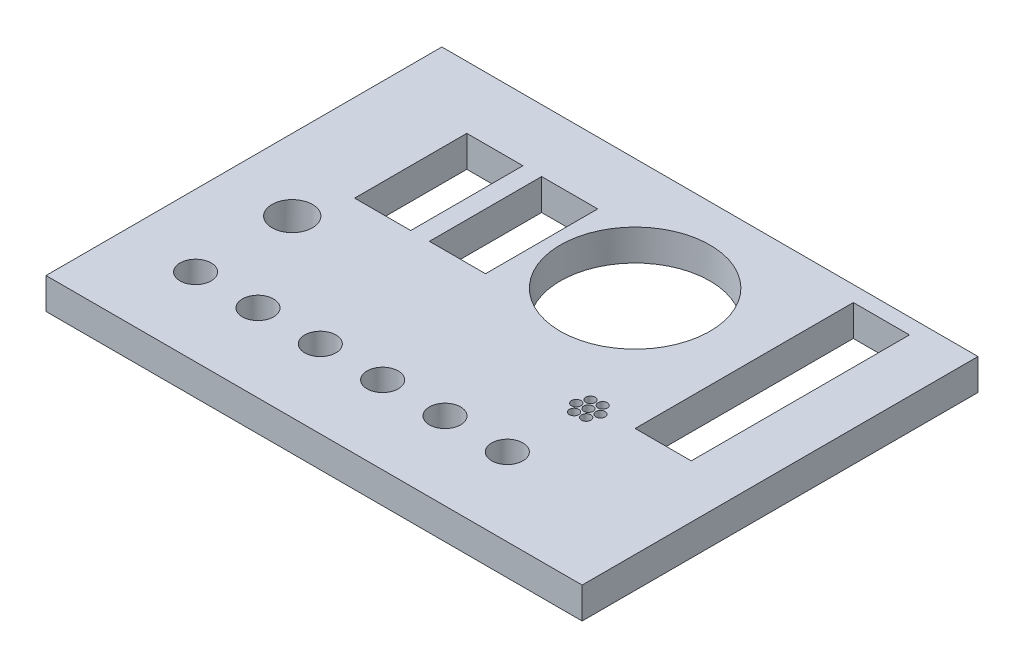
from build123d import *

# Parameters (mm, degrees)
SKICA2_W                 = 86
SKICA2_H                 = 63.5
P_IDAT_VYSUNUT_M1_DEPTH  = 5
ODEBRAT_VYSUNUT_M1_REACH = 55.685
SKICA4_R                 = 2.5
SKICA4_R_2               = 3.25
SKICA4_R_3               = 12
SKICA4_R_4               = 0.75
SKICA4_W                 = 9
SKICA4_H                 = 18
SKICA4_H_2               = 35


with BuildPart() as part:
    # Skica2 → Přidat vysunutím1 (new body)
    with BuildSketch(Plane(origin=(0, 0, 0), x_dir=(1, 0, 0), z_dir=(0, 1, 0))):
        Rectangle(SKICA2_W, SKICA2_H)
    extrude(amount=P_IDAT_VYSUNUT_M1_DEPTH)

    # Skica4 → Odebrat vysunutím1 (cut, up to next)
    with BuildSketch(Plane(origin=(0, 5, 0), x_dir=(1, 0, 0), z_dir=(0, 1, 0)), mode=Mode.PRIVATE) as odebrat_vysunut_m1_sk1:
        with Locations(Location((-31.5, -19.25, 0), (0, 0, 270))):
            Circle(SKICA4_R)
    odebrat_vysunut_m1_tool1 = extrude(odebrat_vysunut_m1_sk1.sketch, amount=-ODEBRAT_VYSUNUT_M1_REACH, mode=Mode.PRIVATE) & part.part
    # Skica4 → Odebrat vysunutím1 (cut, up to next)
    with BuildSketch(Plane(origin=(0, 5, 0), x_dir=(1, 0, 0), z_dir=(0, 1, 0)), mode=Mode.PRIVATE) as odebrat_vysunut_m1_sk2:
        with Locations(Location((-21.5, -19.25, 0), (0, 0, 270))):
            Circle(SKICA4_R)
    odebrat_vysunut_m1_tool2 = extrude(odebrat_vysunut_m1_sk2.sketch, amount=-ODEBRAT_VYSUNUT_M1_REACH, mode=Mode.PRIVATE) & part.part
    # Skica4 → Odebrat vysunutím1 (cut, up to next)
    with BuildSketch(Plane(origin=(0, 5, 0), x_dir=(1, 0, 0), z_dir=(0, 1, 0)), mode=Mode.PRIVATE) as odebrat_vysunut_m1_sk3:
        with Locations(Location((-11.5, -19.25, 0), (0, 0, 270))):
            Circle(SKICA4_R)
    odebrat_vysunut_m1_tool3 = extrude(odebrat_vysunut_m1_sk3.sketch, amount=-ODEBRAT_VYSUNUT_M1_REACH, mode=Mode.PRIVATE) & part.part
    # Skica4 → Odebrat vysunutím1 (cut, up to next)
    with BuildSketch(Plane(origin=(0, 5, 0), x_dir=(1, 0, 0), z_dir=(0, 1, 0)), mode=Mode.PRIVATE) as odebrat_vysunut_m1_sk4:
        with Locations(Location((-1.5, -19.25, 0), (0, 0, 270))):
            Circle(SKICA4_R)
    odebrat_vysunut_m1_tool4 = extrude(odebrat_vysunut_m1_sk4.sketch, amount=-ODEBRAT_VYSUNUT_M1_REACH, mode=Mode.PRIVATE) & part.part
    # Skica4 → Odebrat vysunutím1 (cut, up to next)
    with BuildSketch(Plane(origin=(0, 5, 0), x_dir=(1, 0, 0), z_dir=(0, 1, 0)), mode=Mode.PRIVATE) as odebrat_vysunut_m1_sk5:
        with Locations(Location((8.5, -19.25, 0), (0, 0, 270))):
            Circle(SKICA4_R)
    odebrat_vysunut_m1_tool5 = extrude(odebrat_vysunut_m1_sk5.sketch, amount=-ODEBRAT_VYSUNUT_M1_REACH, mode=Mode.PRIVATE) & part.part
    # Skica4 → Odebrat vysunutím1 (cut, up to next)
    with BuildSketch(Plane(origin=(0, 5, 0), x_dir=(1, 0, 0), z_dir=(0, 1, 0)), mode=Mode.PRIVATE) as odebrat_vysunut_m1_sk6:
        with Locations(Location((18.5, -19.25, 0), (0, 0, 270))):
            Circle(SKICA4_R)
    odebrat_vysunut_m1_tool6 = extrude(odebrat_vysunut_m1_sk6.sketch, amount=-ODEBRAT_VYSUNUT_M1_REACH, mode=Mode.PRIVATE) & part.part
    # Skica4 → Odebrat vysunutím1 (cut, up to next)
    with BuildSketch(Plane(origin=(0, 5, 0), x_dir=(1, 0, 0), z_dir=(0, 1, 0)), mode=Mode.PRIVATE) as odebrat_vysunut_m1_sk7:
        with Locations(Location((-31.5, -3.75, 0), (0, 0, 270))):
            Circle(SKICA4_R_2)
    odebrat_vysunut_m1_tool7 = extrude(odebrat_vysunut_m1_sk7.sketch, amount=-ODEBRAT_VYSUNUT_M1_REACH, mode=Mode.PRIVATE) & part.part
    # Skica4 → Odebrat vysunutím1 (cut, up to next)
    with BuildSketch(Plane(origin=(0, 5, 0), x_dir=(1, 0, 0), z_dir=(0, 1, 0)), mode=Mode.PRIVATE) as odebrat_vysunut_m1_sk8:
        with Locations(Location((6, 13.75, 0), (0, 0, 270))):
            Circle(SKICA4_R_3)
    odebrat_vysunut_m1_tool8 = extrude(odebrat_vysunut_m1_sk8.sketch, amount=-ODEBRAT_VYSUNUT_M1_REACH, mode=Mode.PRIVATE) & part.part
    # Skica4 → Odebrat vysunutím1 (cut, up to next)
    with BuildSketch(Plane(origin=(0, 5, 0), x_dir=(1, 0, 0), z_dir=(0, 1, 0)), mode=Mode.PRIVATE) as odebrat_vysunut_m1_sk9:
        with Locations(Location((17.948758431, -5.350932037, 0), (0, 0, 270))):
            Circle(SKICA4_R_4)
    odebrat_vysunut_m1_tool9 = extrude(odebrat_vysunut_m1_sk9.sketch, amount=-ODEBRAT_VYSUNUT_M1_REACH, mode=Mode.PRIVATE) & part.part
    # Skica4 → Odebrat vysunutím1 (cut, up to next)
    with BuildSketch(Plane(origin=(0, 5, 0), x_dir=(1, 0, 0), z_dir=(0, 1, 0)), mode=Mode.PRIVATE) as odebrat_vysunut_m1_sk10:
        with Locations(Location((19, -6.75, 0), (0, 0, 270))):
            Circle(SKICA4_R_4)
    odebrat_vysunut_m1_tool10 = extrude(odebrat_vysunut_m1_sk10.sketch, amount=-ODEBRAT_VYSUNUT_M1_REACH, mode=Mode.PRIVATE) & part.part
    # Skica4 → Odebrat vysunutím1 (cut, up to next)
    with BuildSketch(Plane(origin=(0, 5, 0), x_dir=(1, 0, 0), z_dir=(0, 1, 0)), mode=Mode.PRIVATE) as odebrat_vysunut_m1_sk11:
        with Locations(Location((19.686007584, -5.140064137, 0), (0, 0, 270))):
            Circle(SKICA4_R_4)
    odebrat_vysunut_m1_tool11 = extrude(odebrat_vysunut_m1_sk11.sketch, amount=-ODEBRAT_VYSUNUT_M1_REACH, mode=Mode.PRIVATE) & part.part
    # Skica4 → Odebrat vysunutím1 (cut, up to next)
    with BuildSketch(Plane(origin=(0, 5, 0), x_dir=(1, 0, 0), z_dir=(0, 1, 0)), mode=Mode.PRIVATE) as odebrat_vysunut_m1_sk12:
        with Locations(Location((20.737249118, -6.539132085, 0), (0, 0, 270))):
            Circle(SKICA4_R_4)
    odebrat_vysunut_m1_tool12 = extrude(odebrat_vysunut_m1_sk12.sketch, amount=-ODEBRAT_VYSUNUT_M1_REACH, mode=Mode.PRIVATE) & part.part
    # Skica4 → Odebrat vysunutím1 (cut, up to next)
    with BuildSketch(Plane(origin=(0, 5, 0), x_dir=(1, 0, 0), z_dir=(0, 1, 0)), mode=Mode.PRIVATE) as odebrat_vysunut_m1_sk13:
        with Locations(Location((20.051241501, -8.149067934, 0), (0, 0, 270))):
            Circle(SKICA4_R_4)
    odebrat_vysunut_m1_tool13 = extrude(odebrat_vysunut_m1_sk13.sketch, amount=-ODEBRAT_VYSUNUT_M1_REACH, mode=Mode.PRIVATE) & part.part
    # Skica4 → Odebrat vysunutím1 (cut, up to next)
    with BuildSketch(Plane(origin=(0, 5, 0), x_dir=(1, 0, 0), z_dir=(0, 1, 0)), mode=Mode.PRIVATE) as odebrat_vysunut_m1_sk14:
        with Locations(Location((18.313992349, -8.359935834, 0), (0, 0, 270))):
            Circle(SKICA4_R_4)
    odebrat_vysunut_m1_tool14 = extrude(odebrat_vysunut_m1_sk14.sketch, amount=-ODEBRAT_VYSUNUT_M1_REACH, mode=Mode.PRIVATE) & part.part
    # Skica4 → Odebrat vysunutím1 (cut, up to next)
    with BuildSketch(Plane(origin=(0, 5, 0), x_dir=(1, 0, 0), z_dir=(0, 1, 0)), mode=Mode.PRIVATE) as odebrat_vysunut_m1_sk15:
        with Locations(Location((17.262750814, -6.960867886, 0), (0, 0, 270))):
            Circle(SKICA4_R_4)
    odebrat_vysunut_m1_tool15 = extrude(odebrat_vysunut_m1_sk15.sketch, amount=-ODEBRAT_VYSUNUT_M1_REACH, mode=Mode.PRIVATE) & part.part
    # Skica4 → Odebrat vysunutím1 (cut, up to next)
    with BuildSketch(Plane(origin=(0, 5, 0), x_dir=(1, 0, 0), z_dir=(0, 1, 0)), mode=Mode.PRIVATE) as odebrat_vysunut_m1_sk16:
        with Locations((-24.5, 12.75)):
            Rectangle(SKICA4_W, SKICA4_H)
    odebrat_vysunut_m1_tool16 = extrude(odebrat_vysunut_m1_sk16.sketch, amount=-ODEBRAT_VYSUNUT_M1_REACH, mode=Mode.PRIVATE) & part.part
    # Skica4 → Odebrat vysunutím1 (cut, up to next)
    with BuildSketch(Plane(origin=(0, 5, 0), x_dir=(1, 0, 0), z_dir=(0, 1, 0)), mode=Mode.PRIVATE) as odebrat_vysunut_m1_sk17:
        with Locations((-12.5, 12.75)):
            Rectangle(SKICA4_W, SKICA4_H)
    odebrat_vysunut_m1_tool17 = extrude(odebrat_vysunut_m1_sk17.sketch, amount=-ODEBRAT_VYSUNUT_M1_REACH, mode=Mode.PRIVATE) & part.part
    # Skica4 → Odebrat vysunutím1 (cut, up to next)
    with BuildSketch(Plane(origin=(0, 5, 0), x_dir=(1, 0, 0), z_dir=(0, 1, 0)), mode=Mode.PRIVATE) as odebrat_vysunut_m1_sk18:
        with Locations((30, 11.75)):
            Rectangle(SKICA4_W, SKICA4_H_2)
    odebrat_vysunut_m1_tool18 = extrude(odebrat_vysunut_m1_sk18.sketch, amount=-ODEBRAT_VYSUNUT_M1_REACH, mode=Mode.PRIVATE) & part.part
    add(odebrat_vysunut_m1_tool1.solids().sort_by_distance((-31.5, 5, 19.25))[0], mode=Mode.SUBTRACT)
    add(odebrat_vysunut_m1_tool2.solids().sort_by_distance((-21.5, 5, 19.25))[0], mode=Mode.SUBTRACT)
    add(odebrat_vysunut_m1_tool3.solids().sort_by_distance((-11.5, 5, 19.25))[0], mode=Mode.SUBTRACT)
    add(odebrat_vysunut_m1_tool4.solids().sort_by_distance((-1.5, 5, 19.25))[0], mode=Mode.SUBTRACT)
    add(odebrat_vysunut_m1_tool5.solids().sort_by_distance((8.5, 5, 19.25))[0], mode=Mode.SUBTRACT)
    add(odebrat_vysunut_m1_tool6.solids().sort_by_distance((18.5, 5, 19.25))[0], mode=Mode.SUBTRACT)
    add(odebrat_vysunut_m1_tool7.solids().sort_by_distance((-31.5, 5, 3.75))[0], mode=Mode.SUBTRACT)
    add(odebrat_vysunut_m1_tool8.solids().sort_by_distance((6, 5, -13.75))[0], mode=Mode.SUBTRACT)
    add(odebrat_vysunut_m1_tool9.solids().sort_by_distance((17.948758, 5, 5.350932))[0], mode=Mode.SUBTRACT)
    add(odebrat_vysunut_m1_tool10.solids().sort_by_distance((19, 5, 6.75))[0], mode=Mode.SUBTRACT)
    add(odebrat_vysunut_m1_tool11.solids().sort_by_distance((19.686008, 5, 5.140064))[0], mode=Mode.SUBTRACT)
    add(odebrat_vysunut_m1_tool12.solids().sort_by_distance((20.737249, 5, 6.539132))[0], mode=Mode.SUBTRACT)
    add(odebrat_vysunut_m1_tool13.solids().sort_by_distance((20.051242, 5, 8.149068))[0], mode=Mode.SUBTRACT)
    add(odebrat_vysunut_m1_tool14.solids().sort_by_distance((18.313992, 5, 8.359936))[0], mode=Mode.SUBTRACT)
    add(odebrat_vysunut_m1_tool15.solids().sort_by_distance((17.262751, 5, 6.960868))[0], mode=Mode.SUBTRACT)
    add(odebrat_vysunut_m1_tool16.solids().sort_by_distance((-24.5, 5, -12.75))[0], mode=Mode.SUBTRACT)
    add(odebrat_vysunut_m1_tool17.solids().sort_by_distance((-12.5, 5, -12.75))[0], mode=Mode.SUBTRACT)
    add(odebrat_vysunut_m1_tool18.solids().sort_by_distance((30, 5, -11.75))[0], mode=Mode.SUBTRACT)


solid = part.part
